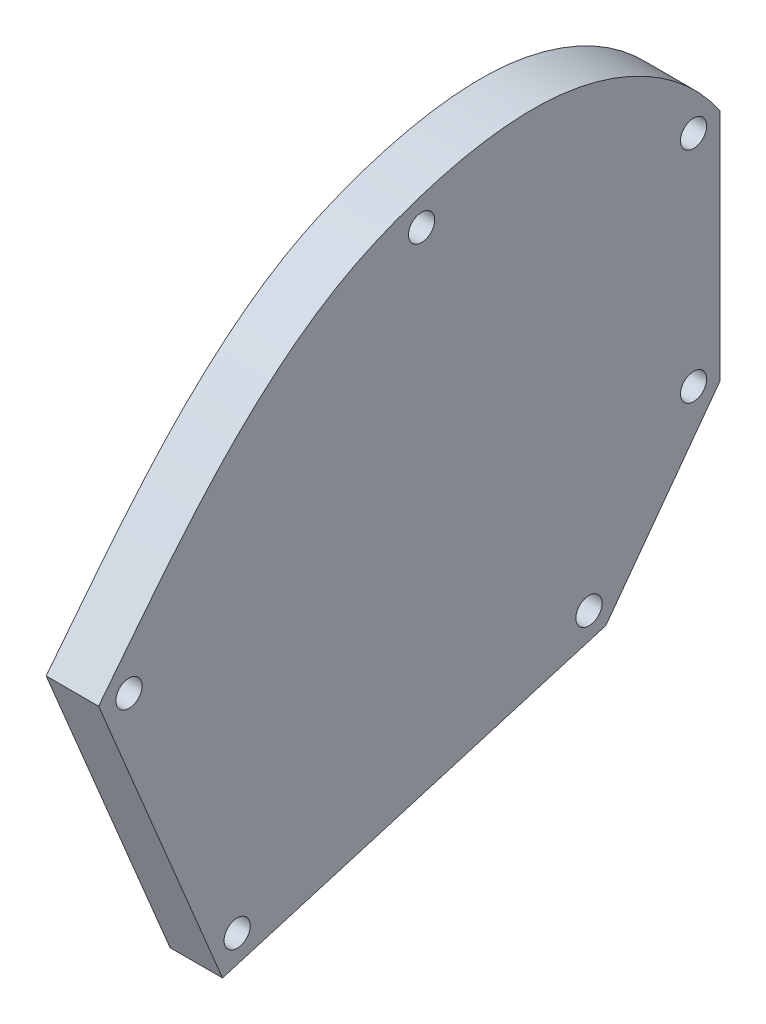
from build123d import *

# Parameters (mm, degrees)
BOSS_EXTRUDE1_DEPTH = 5.08
SKETCH2_R           = 1.27
CUT_EXTRUDE1_DEPTH  = 10


with BuildPart() as part:
    # Sketch1 → Boss-Extrude1 (new body)
    with BuildSketch(Plane(origin=(0, 0, 0), x_dir=(0, 0, -1), z_dir=(1, 0, 0))):
        with BuildLine():
            Line((-30.090800845, -0.203985657), (-18.085491541, -29.008366119))
            Line((-18.085491541, -29.008366119), (19.045846251, -18.010521201))
            Line((19.045846251, -18.010521201), (30.090800845, -3.045918822))
            Line((30.090800845, -3.045918822), (30.090800845, 19.650147268))
            add(Edge.make_bspline(
                [(30.090800845, 19.650147268), (28.037602076, 22.726688549), (23.033153586, 26.860701903), (14.987767723, 29.008366119), (7.524677055, 28.774184664), (0.603908496, 27.036559666), (-6.727735861, 23.899909345), (-13.041122451, 19.375109172), (-21.198561263, 11.380500033), (-26.40610074, 4.431018315), (-30.090800845, -0.203985657)],
                knots=[0, 0, 0, 0, 0.148846654, 0.252987858, 0.329376305, 0.448668947, 0.539169161, 0.650373484, 0.760197294, 1, 1, 1, 1], degree=3))
        make_face()
    extrude(amount=BOSS_EXTRUDE1_DEPTH)

    # Sketch2 → Cut-Extrude1 (cut)
    with BuildSketch(Plane(origin=(5.08, 0, 0), x_dir=(0, 0, -1), z_dir=(1, 0, 0))):
        with Locations((-27.1490755, -0.589985571)):
            Circle(SKETCH2_R)
        with Locations((-16.665824451, -25.950337288)):
            Circle(SKETCH2_R)
        with Locations((17.412184036, -15.937519564)):
            Circle(SKETCH2_R)
        with Locations((27.54487652, -2.200233664)):
            Circle(SKETCH2_R)
        with Locations((27.54487652, 19.042163131)):
            Circle(SKETCH2_R)
        with Locations((1.198662119, 24.319887944)):
            Circle(SKETCH2_R)
    extrude(amount=-CUT_EXTRUDE1_DEPTH, mode=Mode.SUBTRACT)


solid = part.part
